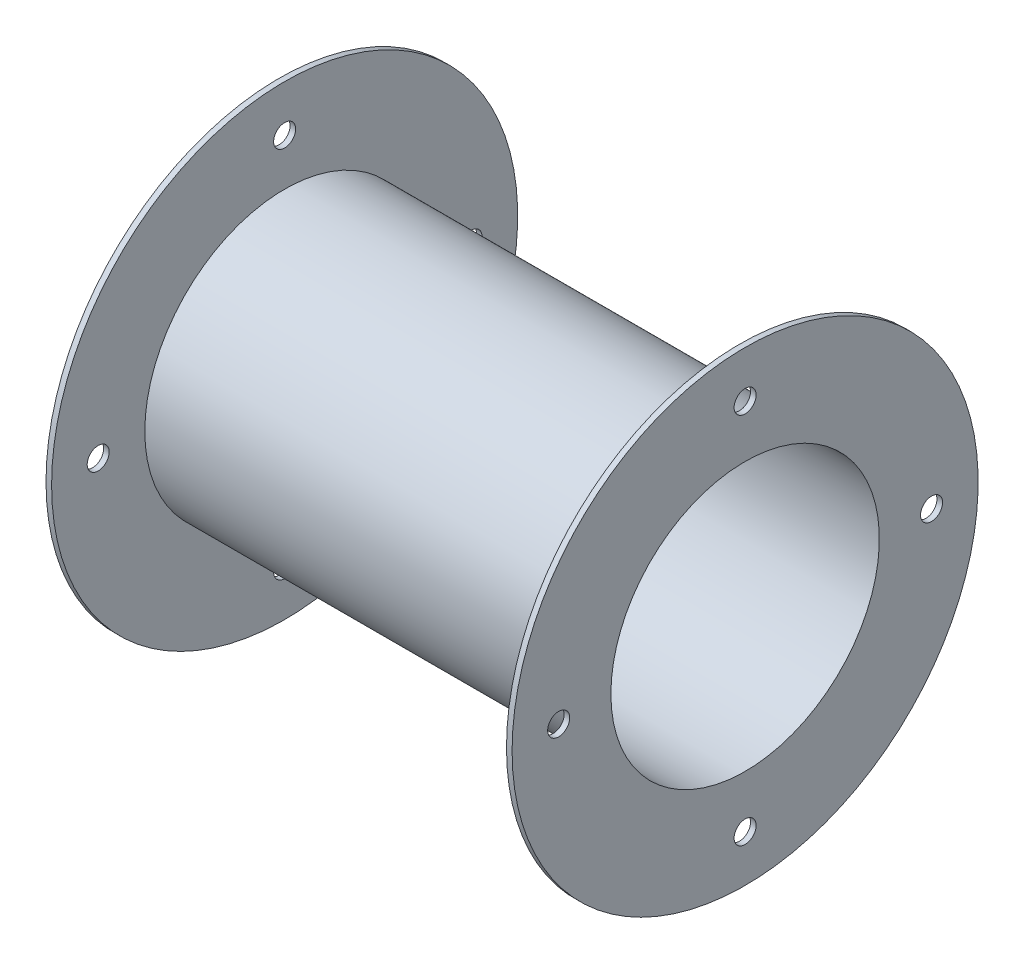
from build123d import *

# Parameters (mm, degrees)
SKETCH4_R          = 3
CUT_EXTRUDE1_DEPTH = 174.713717869
CIRPATTERN1_COUNT  = 4


with BuildPart() as part:
    # Sketch3 → Revolve1 (revolve)
    with BuildSketch(Plane.XY, mode=Mode.PRIVATE) as revolve1_sk:
        Polygon((0, 0), (0, 26.924), (1.524, 26.924), (1.524, 1.524), (125.476, 1.524), (125.476, 26.924), (127, 26.924), (127, 0), align=None)
    revolve(revolve1_sk.sketch.rotate(Axis((-7.37458194, -36.576, 0), (1, 0, 0)), 90), axis=Axis((-7.37458194, -36.576, 0), (1, 0, 0)))

    # Sketch4 → Cut-Extrude1 (cut, symmetric)
    with BuildSketch(Plane.ZY):
        with Locations((0, 14.224)):
            Circle(SKETCH4_R)
    cut_extrude1 = extrude(amount=CUT_EXTRUDE1_DEPTH, both=True, mode=Mode.SUBTRACT)

    # CirPattern1: Cut-Extrude1 ×4 about axis
    cirpattern1_axis = Axis((0, -36.576, 0), (1, 0, 0))
    for i in range(1, CIRPATTERN1_COUNT):
        add(cut_extrude1.rotate(cirpattern1_axis, i * 360 / CIRPATTERN1_COUNT), mode=Mode.SUBTRACT)


solid = part.part
